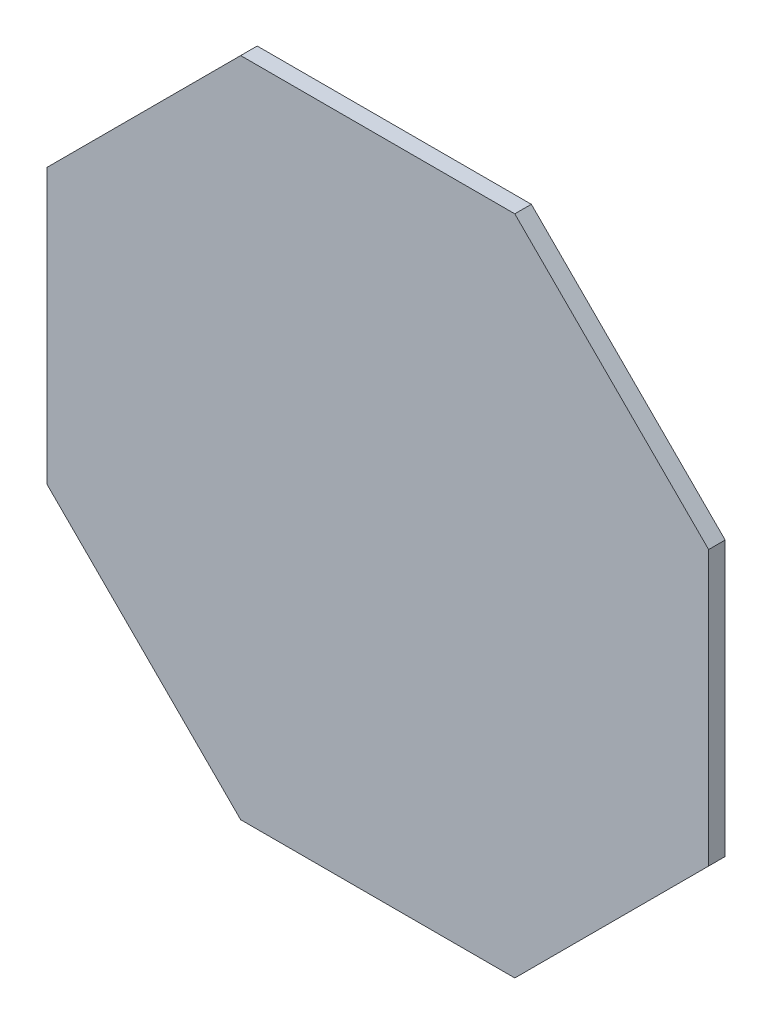
from build123d import *

# Parameters (mm, degrees)
BOSS_EXTRU_1_DEPTH = 2
ESQUISSE3_W        = 14.4
ESQUISSE3_H        = 8.4
ESQUISSE3_W_2      = 10.4
ESQUISSE3_H_2      = 4.4
BOSS_EXTRU_3_DEPTH = 15
D_POUILLE3_ANGLE   = 2


with BuildPart() as part:
    # Esquisse1 → Boss.-Extru.1 (new body)
    with BuildSketch(Plane.XY):
        Polygon((16.568542495, -40), (40, -16.568542495), (40, 16.568542495), (16.568542495, 40), (-16.568542495, 40), (-40, 16.568542495), (-40, -16.568542495), (-16.568542495, -40), align=None)
    extrude(amount=BOSS_EXTRU_1_DEPTH)

    # Esquisse3 → Boss.-Extru.3 (add)
    with BuildSketch(Plane.XZ.offset(40)):
        with Locations((0, -2.3)):
            Rectangle(ESQUISSE3_W, ESQUISSE3_H)
        with Locations((0, -2.3)):
            Rectangle(ESQUISSE3_W_2, ESQUISSE3_H_2, mode=Mode.SUBTRACT)
    extrude(amount=-BOSS_EXTRU_3_DEPTH)

    # Dépouille3
    d_pouille3_faces = [part.faces().sort_by_distance(p)[0] for p in [
        (0, -32.5, -0.1),
        (-5.2, -32.5, -2.3),
        (0, -32.5, -4.5),
        (5.2, -32.5, -2.3),
    ]]
    draft(d_pouille3_faces, Plane(origin=(-16.568542495, -40, 2), x_dir=(-1, 0, 0), z_dir=(0, -1, 0)), D_POUILLE3_ANGLE)


solid = part.part
